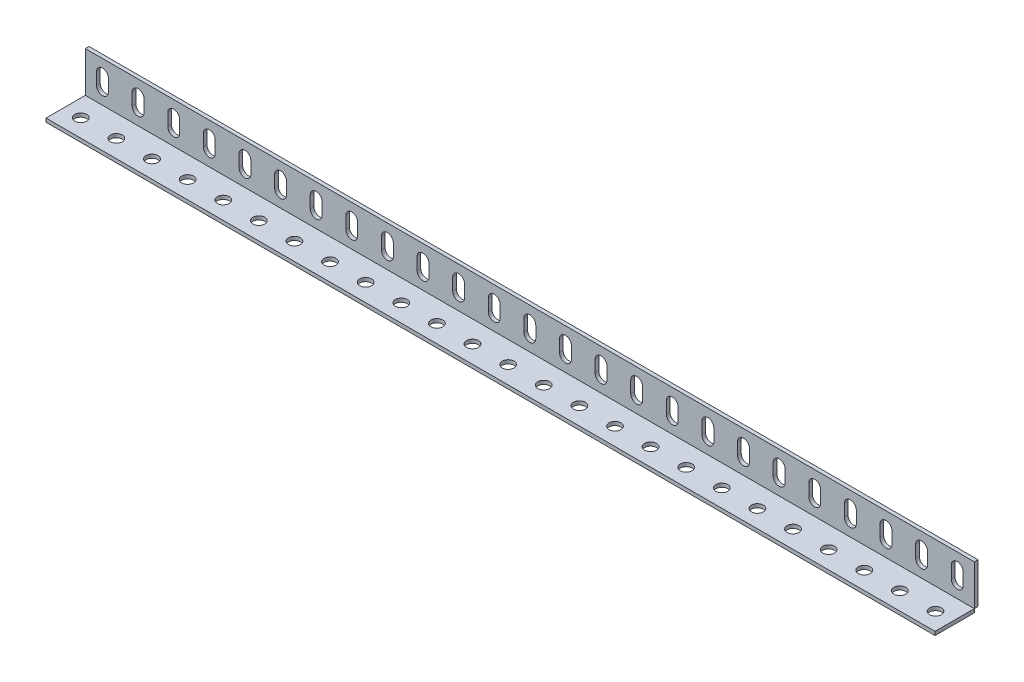
from build123d import *

# Parameters (mm, degrees)
SKETCH1_W           = 316.54
SKETCH1_H           = 14.44
BOSS_EXTRUDE1_DEPTH = 1.3
SKETCH3_W           = 316.54
SKETCH3_H           = 14
SKETCH3_R           = 2.11
BOSS_EXTRUDE5_DEPTH = 1.3


with BuildPart() as part:
    # Sketch1 → Boss-Extrude1 (new body)
    with BuildSketch(Plane.XY):
        with Locations((73.906059827, 0)):
            Rectangle(SKETCH1_W, SKETCH1_H)
        with BuildLine():
            Line((-76.143940173, 2.15), (-76.143940173, -2.15))
            ThreePointArc((-76.143940173, -2.15), (-78.253940173, -4.26), (-80.363940173, -2.15))
            Line((-80.363940173, -2.15), (-80.363940173, 2.15))
            ThreePointArc((-80.363940173, 2.15), (-78.253940173, 4.26), (-76.143940173, 2.15))
        make_face(mode=Mode.SUBTRACT)
        with BuildLine():
            Line((-63.463940173, 2.15), (-63.463940173, -2.15))
            ThreePointArc((-63.463940173, -2.15), (-65.573940173, -4.26), (-67.683940173, -2.15))
            Line((-67.683940173, -2.15), (-67.683940173, 2.15))
            ThreePointArc((-67.683940173, 2.15), (-65.573940173, 4.26), (-63.463940173, 2.15))
        make_face(mode=Mode.SUBTRACT)
        with BuildLine():
            Line((-50.783940173, 2.15), (-50.783940173, -2.15))
            ThreePointArc((-50.783940173, -2.15), (-52.893940173, -4.26), (-55.003940173, -2.15))
            Line((-55.003940173, -2.15), (-55.003940173, 2.15))
            ThreePointArc((-55.003940173, 2.15), (-52.893940173, 4.26), (-50.783940173, 2.15))
        make_face(mode=Mode.SUBTRACT)
        with BuildLine():
            Line((-38.103940173, 2.15), (-38.103940173, -2.15))
            ThreePointArc((-38.103940173, -2.15), (-40.213940173, -4.26), (-42.323940173, -2.15))
            Line((-42.323940173, -2.15), (-42.323940173, 2.15))
            ThreePointArc((-42.323940173, 2.15), (-40.213940173, 4.26), (-38.103940173, 2.15))
        make_face(mode=Mode.SUBTRACT)
        with BuildLine():
            Line((-25.423940173, 2.15), (-25.423940173, -2.15))
            ThreePointArc((-25.423940173, -2.15), (-27.533940173, -4.26), (-29.643940173, -2.15))
            Line((-29.643940173, -2.15), (-29.643940173, 2.15))
            ThreePointArc((-29.643940173, 2.15), (-27.533940173, 4.26), (-25.423940173, 2.15))
        make_face(mode=Mode.SUBTRACT)
        with BuildLine():
            Line((-12.743940173, 2.15), (-12.743940173, -2.15))
            ThreePointArc((-12.743940173, -2.15), (-14.853940173, -4.26), (-16.963940173, -2.15))
            Line((-16.963940173, -2.15), (-16.963940173, 2.15))
            ThreePointArc((-16.963940173, 2.15), (-14.853940173, 4.26), (-12.743940173, 2.15))
        make_face(mode=Mode.SUBTRACT)
        with BuildLine():
            Line((-0.063940173, 2.15), (-0.063940173, -2.15))
            ThreePointArc((-0.063940173, -2.15), (-2.173940173, -4.26), (-4.283940173, -2.15))
            Line((-4.283940173, -2.15), (-4.283940173, 2.15))
            ThreePointArc((-4.283940173, 2.15), (-2.173940173, 4.26), (-0.063940173, 2.15))
        make_face(mode=Mode.SUBTRACT)
        with BuildLine():
            Line((12.616059827, 2.15), (12.616059827, -2.15))
            ThreePointArc((12.616059827, -2.15), (10.506059827, -4.26), (8.396059827, -2.15))
            Line((8.396059827, -2.15), (8.396059827, 2.15))
            ThreePointArc((8.396059827, 2.15), (10.506059827, 4.26), (12.616059827, 2.15))
        make_face(mode=Mode.SUBTRACT)
        with BuildLine():
            Line((25.296059827, 2.15), (25.296059827, -2.15))
            ThreePointArc((25.296059827, -2.15), (23.186059827, -4.26), (21.076059827, -2.15))
            Line((21.076059827, -2.15), (21.076059827, 2.15))
            ThreePointArc((21.076059827, 2.15), (23.186059827, 4.26), (25.296059827, 2.15))
        make_face(mode=Mode.SUBTRACT)
        with BuildLine():
            Line((37.976059827, 2.15), (37.976059827, -2.15))
            ThreePointArc((37.976059827, -2.15), (35.866059827, -4.26), (33.756059827, -2.15))
            Line((33.756059827, -2.15), (33.756059827, 2.15))
            ThreePointArc((33.756059827, 2.15), (35.866059827, 4.26), (37.976059827, 2.15))
        make_face(mode=Mode.SUBTRACT)
        with BuildLine():
            Line((50.656059827, 2.15), (50.656059827, -2.15))
            ThreePointArc((50.656059827, -2.15), (48.546059827, -4.26), (46.436059827, -2.15))
            Line((46.436059827, -2.15), (46.436059827, 2.15))
            ThreePointArc((46.436059827, 2.15), (48.546059827, 4.26), (50.656059827, 2.15))
        make_face(mode=Mode.SUBTRACT)
        with BuildLine():
            Line((63.336059827, 2.15), (63.336059827, -2.15))
            ThreePointArc((63.336059827, -2.15), (61.226059827, -4.26), (59.116059827, -2.15))
            Line((59.116059827, -2.15), (59.116059827, 2.15))
            ThreePointArc((59.116059827, 2.15), (61.226059827, 4.26), (63.336059827, 2.15))
        make_face(mode=Mode.SUBTRACT)
        with BuildLine():
            Line((76.016059827, 2.15), (76.016059827, -2.15))
            ThreePointArc((76.016059827, -2.15), (73.906059827, -4.26), (71.796059827, -2.15))
            Line((71.796059827, -2.15), (71.796059827, 2.15))
            ThreePointArc((71.796059827, 2.15), (73.906059827, 4.26), (76.016059827, 2.15))
        make_face(mode=Mode.SUBTRACT)
        with BuildLine():
            Line((88.696059827, 2.15), (88.696059827, -2.15))
            ThreePointArc((88.696059827, -2.15), (86.586059827, -4.26), (84.476059827, -2.15))
            Line((84.476059827, -2.15), (84.476059827, 2.15))
            ThreePointArc((84.476059827, 2.15), (86.586059827, 4.26), (88.696059827, 2.15))
        make_face(mode=Mode.SUBTRACT)
        with BuildLine():
            Line((101.376059827, 2.15), (101.376059827, -2.15))
            ThreePointArc((101.376059827, -2.15), (99.266059827, -4.26), (97.156059827, -2.15))
            Line((97.156059827, -2.15), (97.156059827, 2.15))
            ThreePointArc((97.156059827, 2.15), (99.266059827, 4.26), (101.376059827, 2.15))
        make_face(mode=Mode.SUBTRACT)
        with BuildLine():
            Line((114.056059827, 2.15), (114.056059827, -2.15))
            ThreePointArc((114.056059827, -2.15), (111.946059827, -4.26), (109.836059827, -2.15))
            Line((109.836059827, -2.15), (109.836059827, 2.15))
            ThreePointArc((109.836059827, 2.15), (111.946059827, 4.26), (114.056059827, 2.15))
        make_face(mode=Mode.SUBTRACT)
        with BuildLine():
            Line((126.736059827, 2.15), (126.736059827, -2.15))
            ThreePointArc((126.736059827, -2.15), (124.626059827, -4.26), (122.516059827, -2.15))
            Line((122.516059827, -2.15), (122.516059827, 2.15))
            ThreePointArc((122.516059827, 2.15), (124.626059827, 4.26), (126.736059827, 2.15))
        make_face(mode=Mode.SUBTRACT)
        with BuildLine():
            Line((139.416059827, 2.15), (139.416059827, -2.15))
            ThreePointArc((139.416059827, -2.15), (137.306059827, -4.26), (135.196059827, -2.15))
            Line((135.196059827, -2.15), (135.196059827, 2.15))
            ThreePointArc((135.196059827, 2.15), (137.306059827, 4.26), (139.416059827, 2.15))
        make_face(mode=Mode.SUBTRACT)
        with BuildLine():
            Line((152.096059827, 2.15), (152.096059827, -2.15))
            ThreePointArc((152.096059827, -2.15), (149.986059827, -4.26), (147.876059827, -2.15))
            Line((147.876059827, -2.15), (147.876059827, 2.15))
            ThreePointArc((147.876059827, 2.15), (149.986059827, 4.26), (152.096059827, 2.15))
        make_face(mode=Mode.SUBTRACT)
        with BuildLine():
            Line((164.776059827, 2.15), (164.776059827, -2.15))
            ThreePointArc((164.776059827, -2.15), (162.666059827, -4.26), (160.556059827, -2.15))
            Line((160.556059827, -2.15), (160.556059827, 2.15))
            ThreePointArc((160.556059827, 2.15), (162.666059827, 4.26), (164.776059827, 2.15))
        make_face(mode=Mode.SUBTRACT)
        with BuildLine():
            Line((177.456059827, 2.15), (177.456059827, -2.15))
            ThreePointArc((177.456059827, -2.15), (175.346059827, -4.26), (173.236059827, -2.15))
            Line((173.236059827, -2.15), (173.236059827, 2.15))
            ThreePointArc((173.236059827, 2.15), (175.346059827, 4.26), (177.456059827, 2.15))
        make_face(mode=Mode.SUBTRACT)
        with BuildLine():
            Line((190.136059827, 2.15), (190.136059827, -2.15))
            ThreePointArc((190.136059827, -2.15), (188.026059827, -4.26), (185.916059827, -2.15))
            Line((185.916059827, -2.15), (185.916059827, 2.15))
            ThreePointArc((185.916059827, 2.15), (188.026059827, 4.26), (190.136059827, 2.15))
        make_face(mode=Mode.SUBTRACT)
        with BuildLine():
            Line((202.816059827, 2.15), (202.816059827, -2.15))
            ThreePointArc((202.816059827, -2.15), (200.706059827, -4.26), (198.596059827, -2.15))
            Line((198.596059827, -2.15), (198.596059827, 2.15))
            ThreePointArc((198.596059827, 2.15), (200.706059827, 4.26), (202.816059827, 2.15))
        make_face(mode=Mode.SUBTRACT)
        with BuildLine():
            Line((215.496059827, 2.15), (215.496059827, -2.15))
            ThreePointArc((215.496059827, -2.15), (213.386059827, -4.26), (211.276059827, -2.15))
            Line((211.276059827, -2.15), (211.276059827, 2.15))
            ThreePointArc((211.276059827, 2.15), (213.386059827, 4.26), (215.496059827, 2.15))
        make_face(mode=Mode.SUBTRACT)
        with BuildLine():
            Line((228.176059827, 2.15), (228.176059827, -2.15))
            ThreePointArc((228.176059827, -2.15), (226.066059827, -4.26), (223.956059827, -2.15))
            Line((223.956059827, -2.15), (223.956059827, 2.15))
            ThreePointArc((223.956059827, 2.15), (226.066059827, 4.26), (228.176059827, 2.15))
        make_face(mode=Mode.SUBTRACT)
    extrude(amount=BOSS_EXTRUDE1_DEPTH)


with BuildPart() as body_2:
    # Sketch3 → Boss-Extrude5 (new body)
    with BuildSketch(Plane.XZ.offset(7.22)):
        with Locations((73.906059827, 8.3)):
            Rectangle(SKETCH3_W, SKETCH3_H)
        with Locations((-78.253940173, 9.03)):
            Circle(SKETCH3_R, mode=Mode.SUBTRACT)
        with Locations((-65.573940173, 9.03)):
            Circle(SKETCH3_R, mode=Mode.SUBTRACT)
        with Locations((-52.893940173, 9.03)):
            Circle(SKETCH3_R, mode=Mode.SUBTRACT)
        with Locations((-40.213940173, 9.03)):
            Circle(SKETCH3_R, mode=Mode.SUBTRACT)
        with Locations((-27.533940173, 9.03)):
            Circle(SKETCH3_R, mode=Mode.SUBTRACT)
        with Locations((-14.853940173, 9.03)):
            Circle(SKETCH3_R, mode=Mode.SUBTRACT)
        with Locations((-2.173940173, 9.03)):
            Circle(SKETCH3_R, mode=Mode.SUBTRACT)
        with Locations((10.506059827, 9.03)):
            Circle(SKETCH3_R, mode=Mode.SUBTRACT)
        with Locations((23.186059827, 9.03)):
            Circle(SKETCH3_R, mode=Mode.SUBTRACT)
        with Locations((35.866059827, 9.03)):
            Circle(SKETCH3_R, mode=Mode.SUBTRACT)
        with Locations((48.546059827, 9.03)):
            Circle(SKETCH3_R, mode=Mode.SUBTRACT)
        with Locations((61.226059827, 9.03)):
            Circle(SKETCH3_R, mode=Mode.SUBTRACT)
        with Locations((73.906059827, 9.03)):
            Circle(SKETCH3_R, mode=Mode.SUBTRACT)
        with Locations((86.586059827, 9.03)):
            Circle(SKETCH3_R, mode=Mode.SUBTRACT)
        with Locations((99.266059827, 9.03)):
            Circle(SKETCH3_R, mode=Mode.SUBTRACT)
        with Locations((111.946059827, 9.03)):
            Circle(SKETCH3_R, mode=Mode.SUBTRACT)
        with Locations((124.626059827, 9.03)):
            Circle(SKETCH3_R, mode=Mode.SUBTRACT)
        with Locations((137.306059827, 9.03)):
            Circle(SKETCH3_R, mode=Mode.SUBTRACT)
        with Locations((149.986059827, 9.03)):
            Circle(SKETCH3_R, mode=Mode.SUBTRACT)
        with Locations((162.666059827, 9.03)):
            Circle(SKETCH3_R, mode=Mode.SUBTRACT)
        with Locations((175.346059827, 9.03)):
            Circle(SKETCH3_R, mode=Mode.SUBTRACT)
        with Locations((188.026059827, 9.03)):
            Circle(SKETCH3_R, mode=Mode.SUBTRACT)
        with Locations((200.706059827, 9.03)):
            Circle(SKETCH3_R, mode=Mode.SUBTRACT)
        with Locations((213.386059827, 9.03)):
            Circle(SKETCH3_R, mode=Mode.SUBTRACT)
        with Locations((226.066059827, 9.03)):
            Circle(SKETCH3_R, mode=Mode.SUBTRACT)
    extrude(amount=BOSS_EXTRUDE5_DEPTH)


solid = Compound([part.part, body_2.part])
